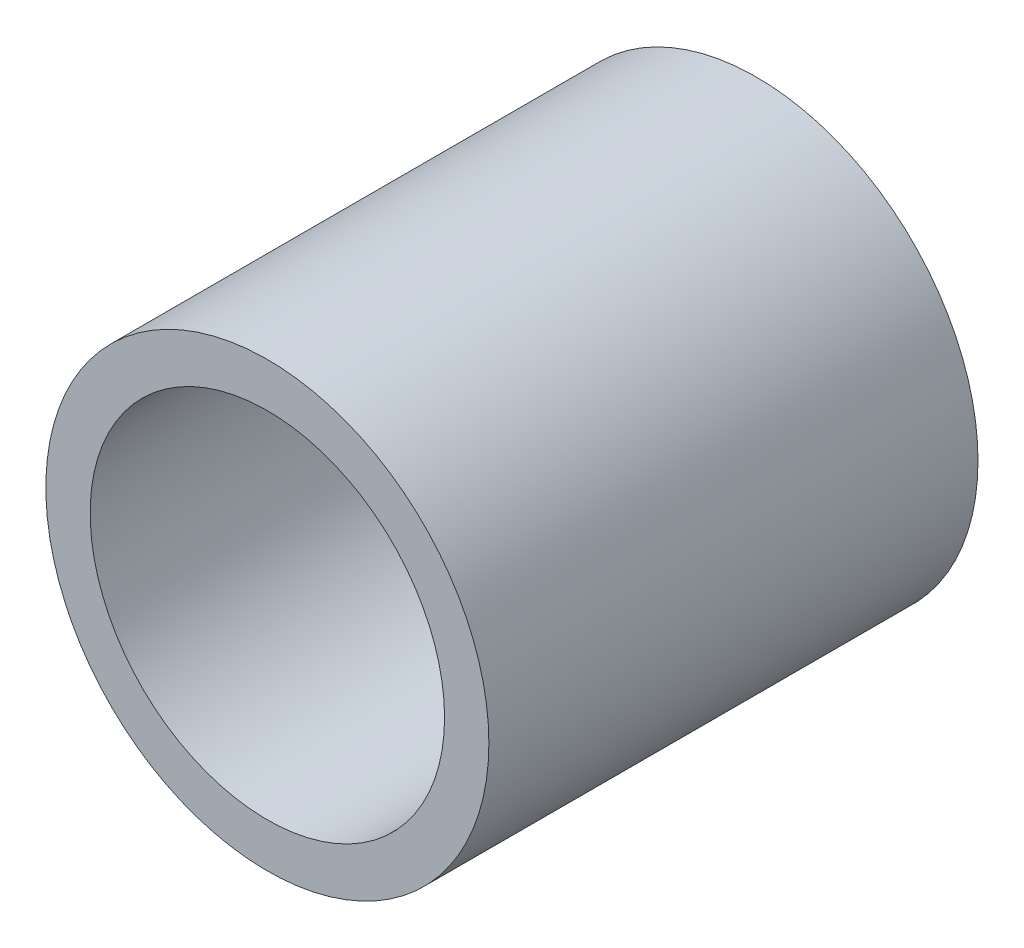
from build123d import *

# Parameters (mm, degrees)
SKETCH1_R           = 0.625
SKETCH1_R_2         = 0.5
BOSS_EXTRUDE1_DEPTH = 1.38


with BuildPart() as part:
    # Sketch1 → Boss-Extrude1 (new body)
    with BuildSketch(Plane.XY):
        Circle(SKETCH1_R)
        Circle(SKETCH1_R_2, mode=Mode.SUBTRACT)
    extrude(amount=BOSS_EXTRUDE1_DEPTH)


solid = part.part
